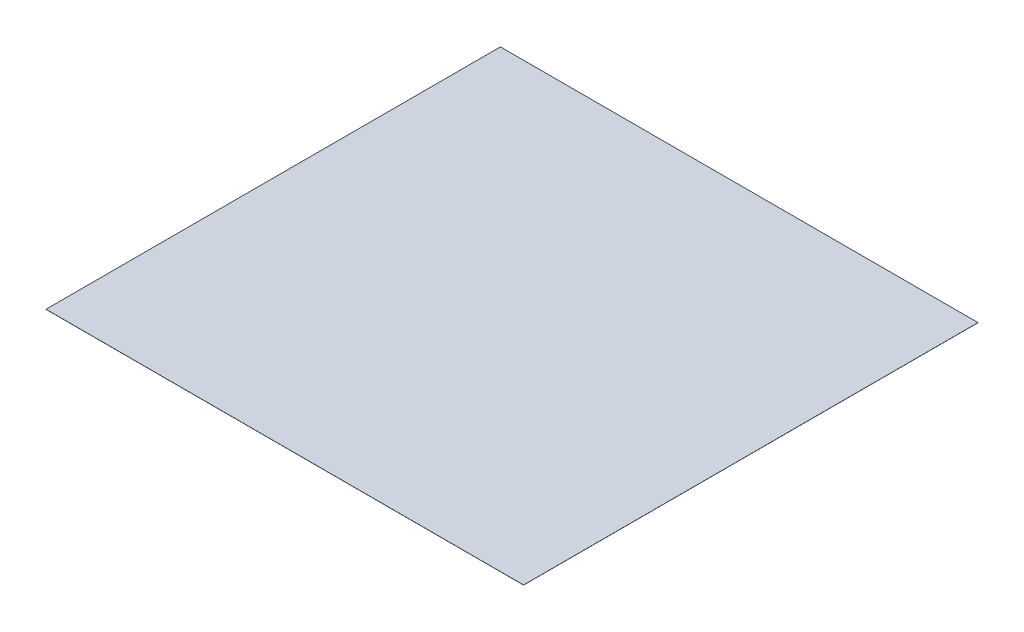
from build123d import *

# Parameters (mm, degrees)
SKETCH1_W           = 201.837704048
SKETCH1_H           = 192.052025882
BOSS_EXTRUDE1_DEPTH = 0.05


with BuildPart() as part:
    # Sketch1 → Boss-Extrude1 (new body)
    with BuildSketch(Plane(origin=(0, 0, 0), x_dir=(1, 0, 0), z_dir=(0, 1, 0))):
        with Locations((0.957067867, -39.594691518)):
            Rectangle(SKETCH1_W, SKETCH1_H)
    extrude(amount=BOSS_EXTRUDE1_DEPTH)


solid = part.part
